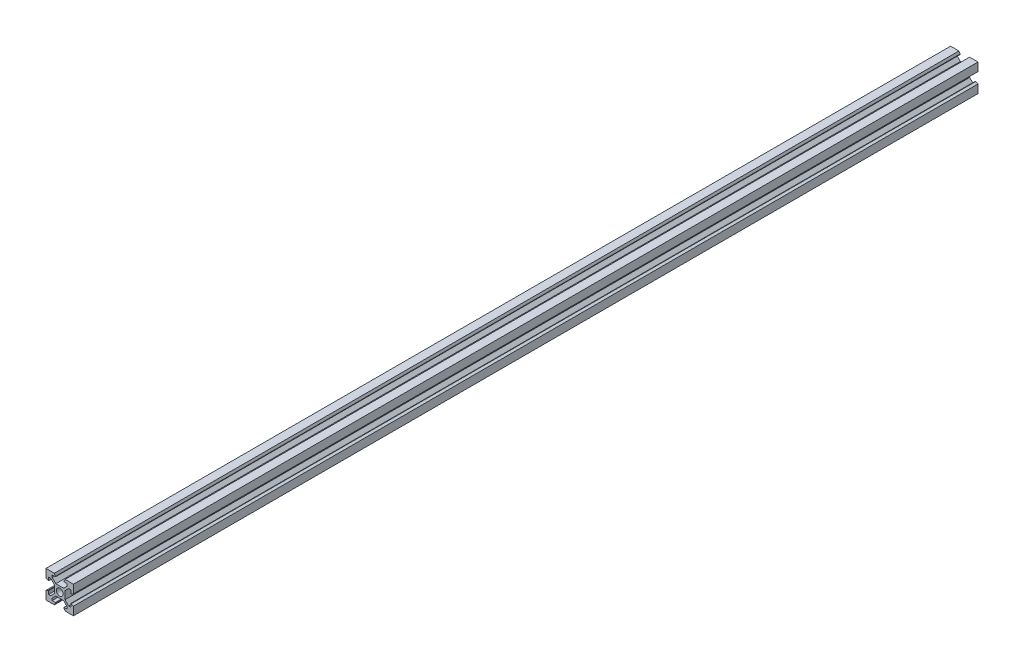
from build123d import *

# Parameters (mm, degrees)
SKETCH1_R           = 2.5
BOSS_EXTRUDE1_DEPTH = 660


with BuildPart() as part:
    # Sketch1 → Boss-Extrude1 (new body)
    with BuildSketch(Plane.XY):
        Polygon((6.1, 20), (0, 20), (0, 13.895792909), (1.56, 13.1), (1.9, 13.1), (1.9, 15.5), (3.439339828, 15.5), (6.1, 12.839339828), (6.1, 7.160660172), (3.439339828, 4.5), (1.9, 4.5), (1.9, 6.9), (1.56, 6.9), (0, 6.104207091), (0, 0), (6.1, 0), (6.9, 1.56), (6.9, 1.9), (4.5, 1.9), (4.5, 3.439339828), (7.160660172, 6.1), (12.839339828, 6.1), (15.5, 3.439339828), (15.5, 1.9), (13.1, 1.9), (13.1, 1.56), (13.9, 0), (20, 0), (20, 6.104207091), (18.44, 6.9), (18.1, 6.9), (18.1, 4.5), (16.560660172, 4.5), (13.9, 7.160660172), (13.9, 12.839339828), (16.560660172, 15.5), (18.1, 15.5), (18.1, 13.1), (18.44, 13.1), (20, 13.895792909), (20, 20), (13.9, 20), (13.1, 18.44), (13.1, 18.1), (15.5, 18.1), (15.5, 16.560660172), (12.839339828, 13.9), (7.160660172, 13.9), (4.5, 16.560660172), (4.5, 18.1), (6.9, 18.1), (6.9, 18.44), align=None)
        with Locations((10, 10)):
            Circle(SKETCH1_R, mode=Mode.SUBTRACT)
    extrude(amount=BOSS_EXTRUDE1_DEPTH)


solid = part.part
